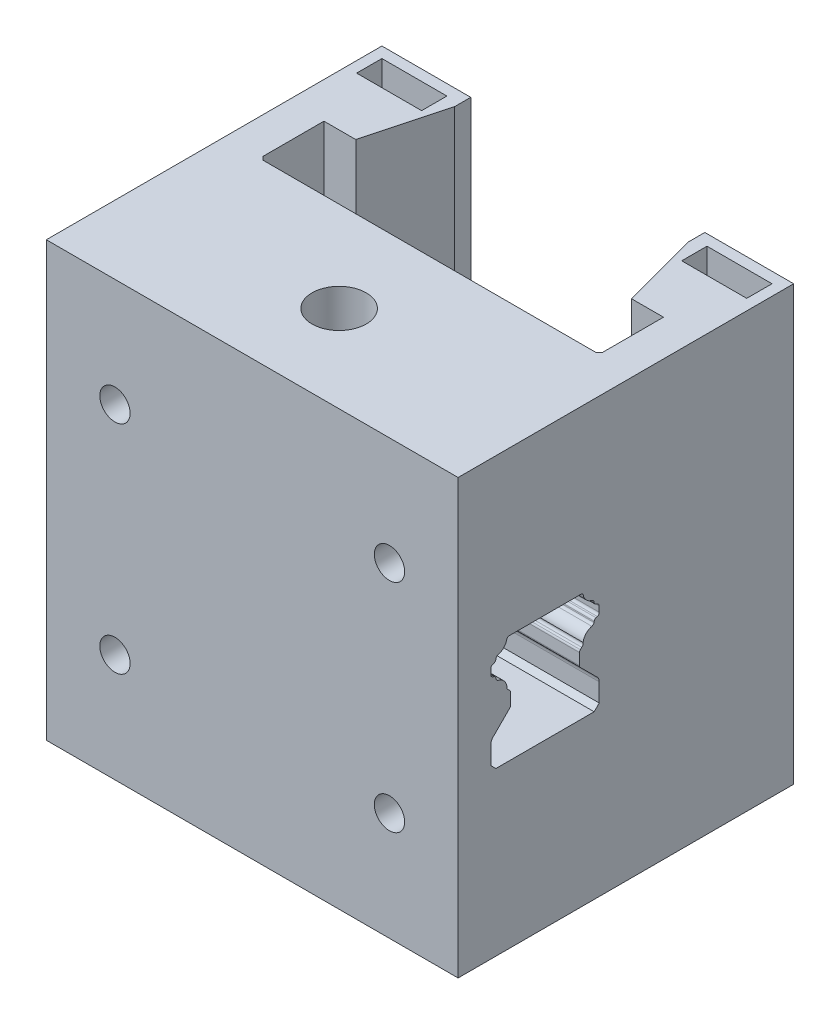
from build123d import *

# Parameters (mm, degrees)
SKETCH1_W           = 57
SKETCH1_H           = 28.7
BOSS_EXTRUDE1_DEPTH = 60
SKETCH2_W           = 9
SKETCH2_H           = 4
CUT_EXTRUDE1_DEPTH  = 69.064473112
BOSS_EXTRUDE2_DEPTH = 28.5
SKETCH6_W           = 15.5
SKETCH6_H           = 15.390476131
CUT_EXTRUDE2_DEPTH  = 80
BOSS_EXTRUDE5_DEPTH = 60
SKETCH10_R          = 2.1
CUT_EXTRUDE3_DEPTH  = 24.530533394
SKETCH11_W          = 61.984050455
SKETCH11_H          = 43.227353824
SKETCH11_W_2        = 6
SKETCH11_H_2        = 2.542732203
CUT_EXTRUDE4_DEPTH  = 77.839254789
SKETCH13_W          = 6.011053281
SKETCH13_H          = 2.620549071
CUT_EXTRUDE5_DEPTH  = 77.839254789
SKETCH14_W          = 9
SKETCH14_H          = 4
BOSS_EXTRUDE7_DEPTH = 60
SKETCH12_W          = 10.230058637
SKETCH12_H          = 6.686923691
BOSS_EXTRUDE6_DEPTH = 60
SKETCH15_W          = 9
SKETCH15_H          = 4
BOSS_EXTRUDE8_DEPTH = 60
SKETCH16_W          = 9
SKETCH16_H          = 1.78
CUT_EXTRUDE6_DEPTH  = 77.839254789
SKETCH17_W          = 25.75
SKETCH17_H          = 20.1006285
CUT_EXTRUDE7_DEPTH  = 77.839254789
SKETCH18_W          = 32.4
SKETCH18_H          = 12.613288226
CUT_EXTRUDE8_DEPTH  = 75.79485996
SKETCH19_W          = 57
SKETCH19_H          = 3.949842852
CUT_EXTRUDE9_DEPTH  = 75.79485996
SKETCH20_W          = 9
SKETCH20_H          = 3.5
CUT_EXTRUDE10_DEPTH = 75.79485996
SKETCH21_W          = 9
SKETCH21_H          = 3.5
CUT_EXTRUDE11_DEPTH = 1.5
SKETCH23_R          = 3.75
CUT_EXTRUDE12_DEPTH = 59.313986952
SKETCH24_R          = 2
CUT_EXTRUDE13_DEPTH = 59.313986952


with BuildPart() as part:
    # Sketch1 → Boss-Extrude1 (new body)
    with BuildSketch(Plane(origin=(0, 0, 0), x_dir=(1, 0, 0), z_dir=(0, 1, 0))):
        with Locations((0, -0.5)):
            Rectangle(SKETCH1_W, SKETCH1_H)
        Polygon((23.07, -9.85), (-23.07, -9.85), (-23.5, -9.42), (-23.5, -0.95), (-19.09385128, -0.95), (-19, -0.599742255), (-16.2, 9.85), (16.2, 9.85), (19, -0.599742255), (19.09385128, -0.95), (23.5, -0.95), (23.5, -2.9), (23.5, -9.42), align=None, mode=Mode.SUBTRACT)
    extrude(amount=BOSS_EXTRUDE1_DEPTH)

    # Sketch2 → Cut-Extrude1 (cut, through all)
    with BuildSketch(Plane.XZ):
        with Locations((24, -10.0706285)):
            Rectangle(SKETCH2_W, SKETCH2_H)
        with Locations((-24, -10.0706285)):
            Rectangle(SKETCH2_W, SKETCH2_H)
    extrude(amount=-CUT_EXTRUDE1_DEPTH, mode=Mode.SUBTRACT)

    # Sketch5 → Boss-Extrude2 (add, symmetric)
    with BuildSketch(Plane(origin=(0, 0, 0), x_dir=(0, 0, -1), z_dir=(1, 0, 0))):
        with BuildLine():
            Line((-14.85, 0), (-14.85, 23.200000017))
            Line((-14.85, 23.200000017), (-15.549999973, 22.50000003))
            Line((-15.549999973, 22.50000003), (-29.149999973, 22.50000003))
            Line((-29.149999973, 22.50000003), (-29.849999973, 23.20000003))
            Line((-29.849999973, 23.20000003), (-29.849999973, 25.743360053))
            ThreePointArc((-29.849999973, 25.743360053), (-29.773879502, 26.126043492), (-29.557106746, 26.450466847))
            Line((-29.557106746, 26.450466847), (-27.237157266, 28.770416328))
            ThreePointArc((-27.237157266, 28.770416328), (-27.150448162, 28.900185674), (-27.119999973, 29.053259055))
            Line((-27.119999973, 29.053259055), (-27.119999973, 30.615319642))
            ThreePointArc((-27.119999973, 30.615319642), (-27.150448164, 30.768393021), (-27.237157268, 30.898162365))
            Line((-27.237157268, 30.898162365), (-27.431588163, 31.09259326))
            ThreePointArc((-27.431588163, 31.09259326), (-27.613507965, 31.297692563), (-27.620638933, 31.57175403))
            ThreePointArc((-27.620638933, 31.57175403), (-28.017573243, 32.42857618), (-28.828543655, 32.91234062))
            ThreePointArc((-28.828543655, 32.91234062), (-29.01918836, 33.020436377), (-29.124259054, 33.212764861))
            Line((-29.124259054, 33.212764861), (-29.156235284, 33.354092333))
            ThreePointArc((-29.156235284, 33.354092333), (-29.24659278, 33.53064407), (-29.410649592, 33.642090719))
            Line((-29.410649592, 33.642090719), (-29.585724304, 33.70524196))
            ThreePointArc((-29.585724304, 33.70524196), (-29.777329878, 33.851609246), (-29.849999973, 34.081511694))
            Line((-29.849999973, 34.081511694), (-29.849999973, 34.837490602))
            ThreePointArc((-29.849999973, 34.837490602), (-29.772088513, 35.074680338), (-29.568705112, 35.219471078))
            Line((-29.568705112, 35.219471078), (-29.427668799, 35.263299846))
            ThreePointArc((-29.427668799, 35.263299846), (-29.25116358, 35.375371369), (-29.155313737, 35.561185593))
            Line((-29.155313737, 35.561185593), (-29.125010632, 35.702102112))
            ThreePointArc((-29.125010632, 35.702102112), (-29.020526118, 35.897067182), (-28.828406063, 36.006695082))
            ThreePointArc((-28.828406063, 36.006695082), (-28.025619489, 36.481556021), (-27.62403672, 37.32339358))
            ThreePointArc((-27.62403672, 37.32339358), (-27.540484938, 37.407225271), (-27.43605838, 37.46293655))
            Line((-27.43605838, 37.46293655), (-27.39899493, 37.5))
            Line((-27.39899493, 37.5), (-17.30100503, 37.5))
            Line((-17.30100503, 37.5), (-17.26394158, 37.46293655))
            ThreePointArc((-17.26394158, 37.46293655), (-17.159515017, 37.407225278), (-17.07596324, 37.32339358))
            ThreePointArc((-17.07596324, 37.32339358), (-16.674380468, 36.481556018), (-15.871593887, 36.006695079))
            ThreePointArc((-15.871593887, 36.006695079), (-15.679473839, 35.897067189), (-15.574989331, 35.702102127))
            Line((-15.574989331, 35.702102127), (-15.544686222, 35.561185587))
            ThreePointArc((-15.544686222, 35.561185587), (-15.448836377, 35.375371364), (-15.272331158, 35.263299843))
            Line((-15.272331158, 35.263299843), (-15.131294869, 35.219471083))
            ThreePointArc((-15.131294869, 35.219471083), (-14.927911462, 35.074680333), (-14.85, 34.837490586))
            Line((-14.85, 34.837490586), (-14.85, 60))
            Line((-14.85, 60), (-34.380533394, 60))
            Line((-34.380533394, 60), (-34.380533394, 0))
            Line((-34.380533394, 0), (-14.85, 0))
        make_face()
        with BuildLine():
            ThreePointArc((-15.142893227, 26.450466847), (-14.926120471, 26.126043492), (-14.85, 25.743360053))
            Line((-14.85, 25.743360053), (-14.85, 34.081511674))
            ThreePointArc((-14.85, 34.081511674), (-14.922670087, 33.851609245), (-15.114275644, 33.70524197))
            Line((-15.114275644, 33.70524197), (-15.289350386, 33.642090718))
            ThreePointArc((-15.289350386, 33.642090718), (-15.453407192, 33.53064407), (-15.543764688, 33.354092339))
            Line((-15.543764688, 33.354092339), (-15.57574092, 33.21276486))
            ThreePointArc((-15.57574092, 33.21276486), (-15.680811613, 33.020436377), (-15.871456319, 32.91234062))
            ThreePointArc((-15.871456319, 32.91234062), (-16.68242673, 32.42857618), (-17.07936104, 31.57175403))
            ThreePointArc((-17.07936104, 31.57175403), (-17.086492012, 31.297692565), (-17.26841181, 31.09259326))
            Line((-17.26841181, 31.09259326), (-17.462842708, 30.898162362))
            ThreePointArc((-17.462842708, 30.898162362), (-17.549551812, 30.768393016), (-17.58, 30.615319635))
            Line((-17.58, 30.615319635), (-17.58, 29.053259048))
            ThreePointArc((-17.58, 29.053259048), (-17.54955181, 28.900185669), (-17.462842705, 28.770416325))
            Line((-17.462842705, 28.770416325), (-15.142893227, 26.450466847))
        make_face()
    extrude(amount=BOSS_EXTRUDE2_DEPTH, both=True)

    # Sketch6 → Cut-Extrude2 (cut)
    with BuildSketch(Plane(origin=(0, 60, 0), x_dir=(1, 0, 0), z_dir=(0, 1, 0))):
        with Locations((0, 12.050145064)):
            Rectangle(SKETCH6_W, SKETCH6_H)
    extrude(amount=-CUT_EXTRUDE2_DEPTH, mode=Mode.SUBTRACT)

    # Sketch9 → Boss-Extrude5 (add)
    with BuildSketch(Plane(origin=(0, 60, 0), x_dir=(1, 0, 0), z_dir=(0, 1, 0))):
        Polygon((-19.5, 13.85), (-19.5, 29.1706285), (-28.5, 29.1706285), (-28.5, 26.1706285), (-33.5, 26.1706285), (-33.5, 32.1706285), (-14.5, 32.1706285), (-14.5, 13.85), align=None)
        Polygon((30.2, 12.85), (30.2, 28.735786438), (19.5, 28.735786438), (19.5, 13.85), (14.5, 13.85), (14.5, 32.1706285), (33.5, 32.1706285), (33.5, 12.85), align=None)
    extrude(amount=-BOSS_EXTRUDE5_DEPTH)

    # Sketch10 → Cut-Extrude3 (cut)
    with BuildSketch(Plane.XY.offset(34.380533394)):
        with Locations((19, 45)):
            Circle(SKETCH10_R)
        with Locations((19, 15)):
            Circle(SKETCH10_R)
        with Locations((-19, 15)):
            Circle(SKETCH10_R)
        with Locations((-19, 45)):
            Circle(SKETCH10_R)
    extrude(amount=-CUT_EXTRUDE3_DEPTH, mode=Mode.SUBTRACT)

    # Sketch11 → Cut-Extrude4 (cut, through all)
    with BuildSketch(Plane.XZ):
        with Locations((44.734239641, -35.463676912)):
            Rectangle(SKETCH11_W, SKETCH11_H)
        with Locations((32.2, -12.566438328)):
            Rectangle(SKETCH11_W_2, SKETCH11_H_2)
    extrude(amount=-CUT_EXTRUDE4_DEPTH, mode=Mode.SUBTRACT)


with BuildPart() as cut_extrude4_piece_1:
    # of the separate pieces the step leaves, piece 1, a body of its own (cut_extrude4_pieces)
    add(part.part.solids().sort_by_distance((-28.5, 23.200000017, 14.85))[0])

    # Sketch14 → Boss-Extrude7 (add, through all)
    with BuildSketch(Plane(origin=(0, 0, 0), x_dir=(-1, 0, 0), z_dir=(0, -1, 0))):
        with Locations((-24, 10.0706285)):
            Rectangle(SKETCH14_W, SKETCH14_H)
    extrude(amount=-BOSS_EXTRUDE7_DEPTH)

    # Sketch12 → Boss-Extrude6 (add, through all)
    with BuildSketch(Plane.XZ):
        with Locations((23.384970682, -10.506538155)):
            Rectangle(SKETCH12_W, SKETCH12_H)
    extrude(amount=-BOSS_EXTRUDE6_DEPTH)

    # Sketch15 → Boss-Extrude8 (add, through all)
    with BuildSketch(Plane(origin=(0, 60, 0), x_dir=(1, 0, 0), z_dir=(0, 1, 0))):
        with Locations((-24, 10.0706285)):
            Rectangle(SKETCH15_W, SKETCH15_H)
    extrude(amount=-BOSS_EXTRUDE8_DEPTH)

    # Sketch16 → Cut-Extrude6 (cut, through all)
    with BuildSketch(Plane(origin=(0, 60, 0), x_dir=(1, 0, 0), z_dir=(0, 1, 0))):
        with Locations((-24, 12.96)):
            Rectangle(SKETCH16_W, SKETCH16_H)
    extrude(amount=-CUT_EXTRUDE6_DEPTH, mode=Mode.SUBTRACT)

    # Sketch17 → Cut-Extrude7 (cut, through all)
    with BuildSketch(Plane(origin=(0, 60, 0), x_dir=(1, 0, 0), z_dir=(0, 1, 0))):
        with Locations((-20.625, 22.12031425)):
            Rectangle(SKETCH17_W, SKETCH17_H)
    extrude(amount=-CUT_EXTRUDE7_DEPTH, mode=Mode.SUBTRACT)

    # Sketch18 → Cut-Extrude8 (cut, through all)
    with BuildSketch(Plane(origin=(0, 60, 0), x_dir=(1, 0, 0), z_dir=(0, 1, 0))):
        with Locations((0, 16.156644113)):
            Rectangle(SKETCH18_W, SKETCH18_H)
    extrude(amount=-CUT_EXTRUDE8_DEPTH, mode=Mode.SUBTRACT)

    # Sketch19 → Cut-Extrude9 (cut, through all)
    with BuildSketch(Plane(origin=(0, 60, 0), x_dir=(1, 0, 0), z_dir=(0, 1, 0))):
        with Locations((0, 14.044921426)):
            Rectangle(SKETCH19_W, SKETCH19_H)
    extrude(amount=-CUT_EXTRUDE9_DEPTH, mode=Mode.SUBTRACT)

    # Sketch20 → Cut-Extrude10 (cut, through all)
    with BuildSketch(Plane(origin=(0, 60, 0), x_dir=(1, 0, 0), z_dir=(0, 1, 0))):
        with Locations((-22.5, 8.82)):
            Rectangle(SKETCH20_W, SKETCH20_H)
        with Locations((22.5, 8.82)):
            Rectangle(SKETCH20_W, SKETCH20_H)
    extrude(amount=-CUT_EXTRUDE10_DEPTH, mode=Mode.SUBTRACT)

    # Sketch21 → Cut-Extrude11 (cut)
    with BuildSketch(Plane(origin=(0, 0, -12.07), x_dir=(-1, 0, 0), z_dir=(0, 0, -1))):
        with Locations((-22.5, 48.25)):
            Rectangle(SKETCH21_W, SKETCH21_H)
        with Locations((22.5, 48.25)):
            Rectangle(SKETCH21_W, SKETCH21_H)
        with Locations((22.5, 11.75)):
            Rectangle(SKETCH21_W, SKETCH21_H)
        with Locations((-22.5, 11.75)):
            Rectangle(SKETCH21_W, SKETCH21_H)
    extrude(amount=-CUT_EXTRUDE11_DEPTH, mode=Mode.SUBTRACT)

    # Sketch23 → Cut-Extrude12 (cut, through all)
    with BuildSketch(Plane(origin=(0, 22.50000003, 0), x_dir=(1, 0, 0), z_dir=(0, 1, 0))):
        with Locations(Location((0, -22.349999973, 0), (0, 0, 90))):
            Circle(SKETCH23_R)
    extrude(amount=CUT_EXTRUDE12_DEPTH, mode=Mode.SUBTRACT)

    # Sketch24 → Cut-Extrude13 (cut, through all)
    with BuildSketch(Plane(origin=(0, 22.50000003, 0), x_dir=(1, 0, 0), z_dir=(0, 1, 0))):
        with Locations(Location((0, -22.349999973, 0), (0, 0, 270))):
            Circle(SKETCH24_R)
    extrude(amount=-CUT_EXTRUDE13_DEPTH, mode=Mode.SUBTRACT)


with BuildPart() as cut_extrude4_piece_2:
    # of the separate pieces the step leaves, piece 2, a body of its own (cut_extrude4_pieces)
    add(part.part.solids().sort_by_distance((33.5, 0, -13.85))[0])

    # Sketch13 → Cut-Extrude5 (cut, through all)
    with BuildSketch(Plane.XZ):
        with Locations((32.65361778, -14.054923964)):
            Rectangle(SKETCH13_W, SKETCH13_H)
    extrude(amount=-CUT_EXTRUDE5_DEPTH, mode=Mode.SUBTRACT)


solid = cut_extrude4_piece_1.part
